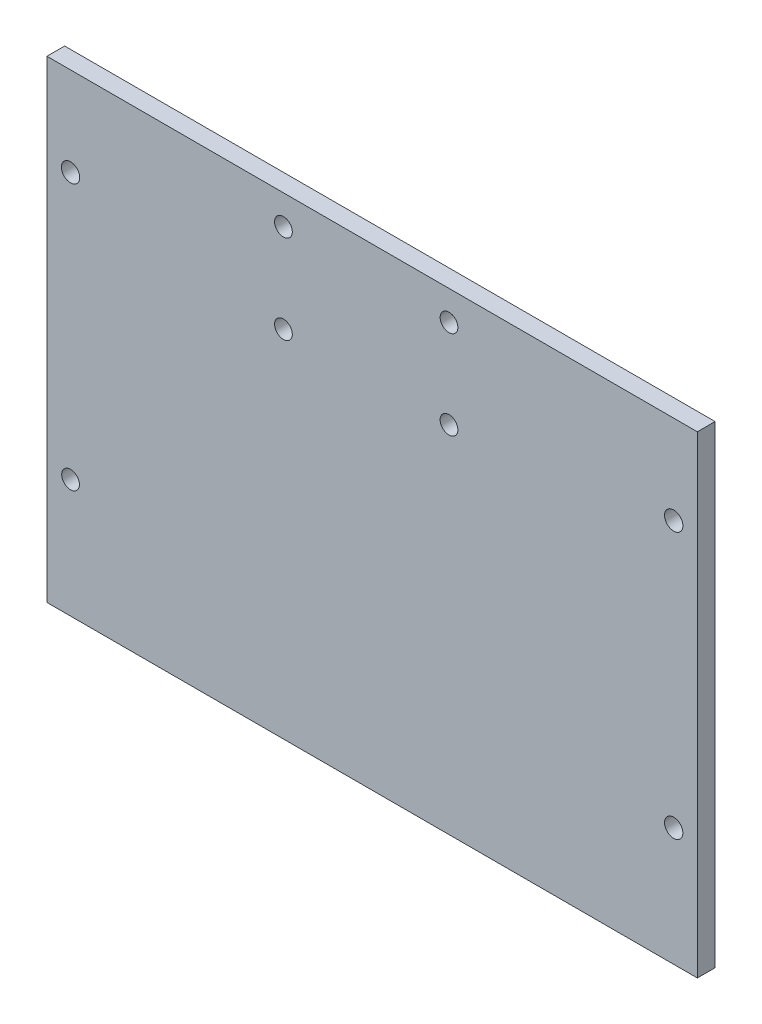
from build123d import *

# Parameters (mm, degrees)
SKETCH_1_W          = 110
SKETCH_1_H          = 80
EXTRUDE_1_DEPTH     = 3
SKETCH_2_R          = 1.5
CUT_EXTRUDE_1_DEPTH = 10
SKETCH_3_R          = 1.55
SKETCH_3_R_2        = 1.5
CUT_EXTRUDE_2_DEPTH = 10


with BuildPart() as part:
    # 草图1 → 凸台-拉伸1 (new body)
    with BuildSketch(Plane.XY):
        Rectangle(SKETCH_1_W, SKETCH_1_H)
    extrude(amount=EXTRUDE_1_DEPTH)

    # 草图2 → 切除-拉伸1 (cut)
    with BuildSketch(Plane(origin=(0, 0, 0), x_dir=(-1, 0, 0), z_dir=(0, 0, -1))):
        with Locations((-13, 20.02)):
            Circle(SKETCH_2_R)
        with Locations((-13, 35.02)):
            Circle(SKETCH_2_R)
        with Locations((15, 20.02)):
            Circle(SKETCH_2_R)
        with Locations((15, 35.02)):
            Circle(SKETCH_2_R)
    extrude(amount=-CUT_EXTRUDE_1_DEPTH, mode=Mode.SUBTRACT)

    # 草图3 → 切除-拉伸2 (cut)
    with BuildSketch(Plane(origin=(0, 0, 0), x_dir=(-1, 0, 0), z_dir=(0, 0, -1))):
        with Locations((-51, -20)):
            Circle(SKETCH_3_R)
        with Locations((-51, 25)):
            Circle(SKETCH_3_R)
        with Locations((51, -20)):
            Circle(SKETCH_3_R_2)
        with Locations((51, 25)):
            Circle(SKETCH_3_R)
    extrude(amount=-CUT_EXTRUDE_2_DEPTH, mode=Mode.SUBTRACT)


solid = part.part
